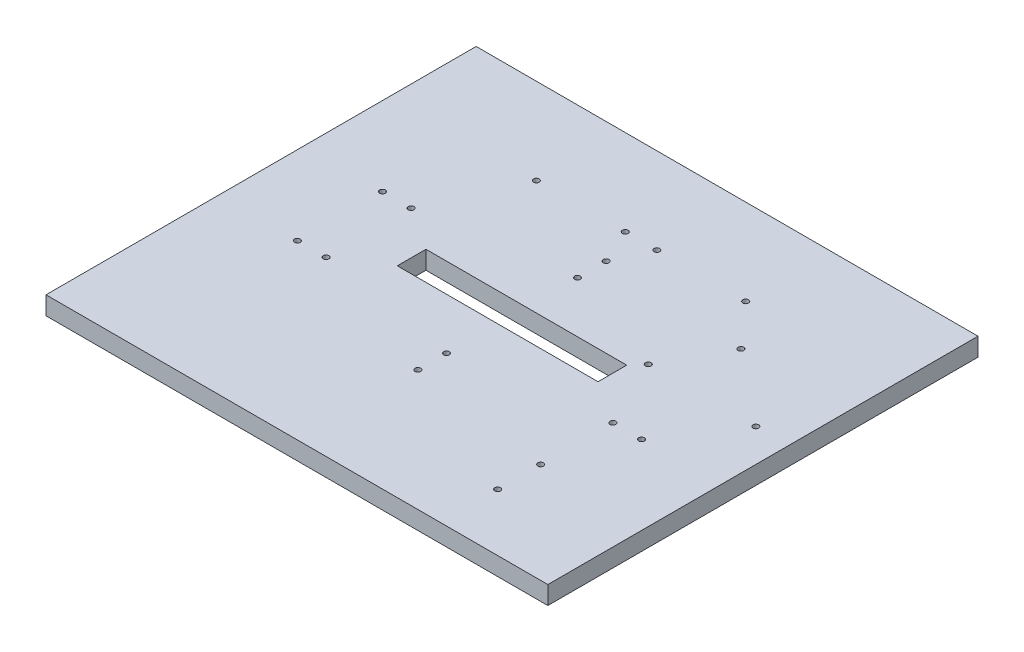
from build123d import *

# Parameters (mm, degrees)
SKETCH1_W           = 350
SKETCH1_H           = 300
SKETCH1_R           = 2
SKETCH1_W_2         = 140
SKETCH1_H_2         = 20
BOSS_EXTRUDE1_DEPTH = 12.7


with BuildPart() as part:
    # Sketch1 → Boss-Extrude1 (new body)
    with BuildSketch(Plane(origin=(0, 0, 0), x_dir=(1, 0, 0), z_dir=(0, 1, 0))):
        with Locations((175, 150)):
            Rectangle(SKETCH1_W, SKETCH1_H)
        with Locations(Location((102, 240, 0), (0, 0, 270))):
            Circle(SKETCH1_R, mode=Mode.SUBTRACT)
        with Locations(Location((248, 240, 0), (0, 0, 270))):
            Circle(SKETCH1_R, mode=Mode.SUBTRACT)
        with Locations(Location((275, 70, 0), (0, 0, 270))):
            Circle(SKETCH1_R, mode=Mode.SUBTRACT)
        with Locations(Location((275, 40, 0), (0, 0, 270))):
            Circle(SKETCH1_R, mode=Mode.SUBTRACT)
        with Locations(Location((186, 240, 0), (0, 0, 270))):
            Circle(SKETCH1_R, mode=Mode.SUBTRACT)
        with Locations(Location((164, 240, 0), (0, 0, 270))):
            Circle(SKETCH1_R, mode=Mode.SUBTRACT)
        with Locations(Location((175, 195.65, 0), (0, 0, 270))):
            Circle(SKETCH1_R, mode=Mode.SUBTRACT)
        with Locations(Location((175, 215.65, 0), (0, 0, 270))):
            Circle(SKETCH1_R, mode=Mode.SUBTRACT)
        with Locations(Location((175, 104.35, 0), (0, 0, 270))):
            Circle(SKETCH1_R, mode=Mode.SUBTRACT)
        with Locations(Location((175, 84.35, 0), (0, 0, 270))):
            Circle(SKETCH1_R, mode=Mode.SUBTRACT)
        with Locations(Location((252.055354108, 168, 0), (0, 0, 270))):
            Circle(SKETCH1_R, mode=Mode.SUBTRACT)
        with Locations(Location((327.055354108, 168, 0), (0, 0, 270))):
            Circle(SKETCH1_R, mode=Mode.SUBTRACT)
        with Locations(Location((75, 120.35, 0), (0, 0, 270))):
            Circle(SKETCH1_R, mode=Mode.SUBTRACT)
        with Locations(Location((55, 120.35, 0), (0, 0, 270))):
            Circle(SKETCH1_R, mode=Mode.SUBTRACT)
        with Locations(Location((275, 120.35, 0), (0, 0, 270))):
            Circle(SKETCH1_R, mode=Mode.SUBTRACT)
        with Locations(Location((295, 120.35, 0), (0, 0, 270))):
            Circle(SKETCH1_R, mode=Mode.SUBTRACT)
        with Locations(Location((75, 179.65, 0), (0, 0, 270))):
            Circle(SKETCH1_R, mode=Mode.SUBTRACT)
        with Locations(Location((55, 179.65, 0), (0, 0, 270))):
            Circle(SKETCH1_R, mode=Mode.SUBTRACT)
        with Locations(Location((275, 209.65, 0), (0, 0, 270))):
            Circle(SKETCH1_R, mode=Mode.SUBTRACT)
        with Locations((175, 150)):
            Rectangle(SKETCH1_W_2, SKETCH1_H_2, mode=Mode.SUBTRACT)
    extrude(amount=BOSS_EXTRUDE1_DEPTH)


solid = part.part
